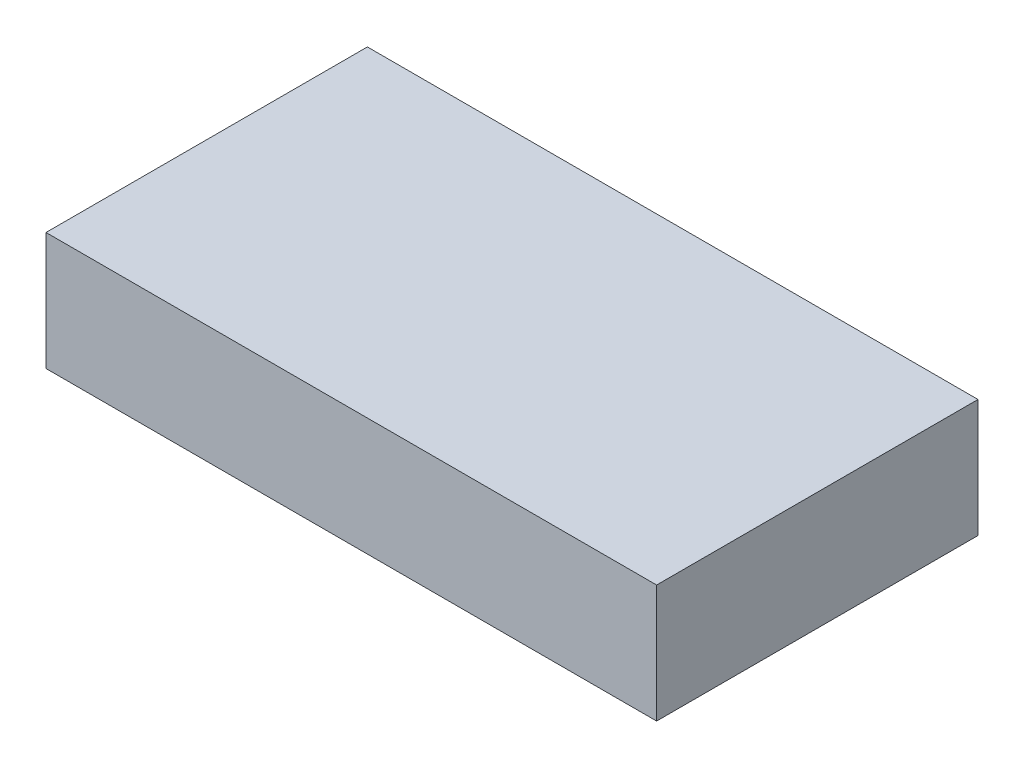
from build123d import *

# Parameters (mm, degrees)
SKETCH1_W           = 30.48
SKETCH1_H           = 11.176
BOSS_EXTRUDE1_DEPTH = 57.912


with BuildPart() as part:
    # Sketch1 → Boss-Extrude1 (new body)
    with BuildSketch(Plane(origin=(0, 0, 0), x_dir=(0, 0, -1), z_dir=(1, 0, 0))):
        Rectangle(SKETCH1_W, SKETCH1_H)
    extrude(amount=BOSS_EXTRUDE1_DEPTH)


solid = part.part
